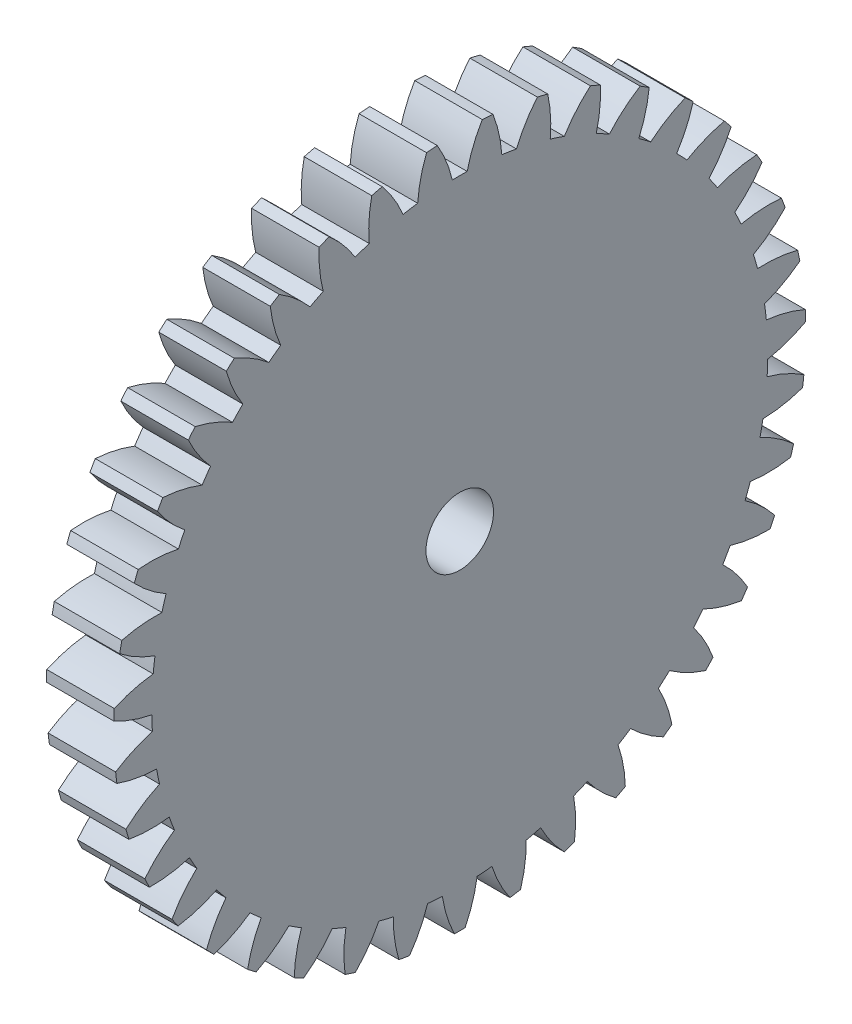
from build123d import *

# Parameters (mm, degrees)
BASPROSKE_W     = 1
BASPROSKE_H     = 5.125
TOOTHCUT_DEPTH  = 8.316505313
TEETHCUTS_COUNT = 39
TEETHCUTS_ANGLE = 350.769230769
BORSKE_R        = 0.5
BORE_DEPTH      = 50.0000508


with BuildPart() as part:
    # BasProSke → Base-Revolve (revolve)
    with BuildSketch(Plane(origin=(0, 0, 0), x_dir=(1, 0, 0), z_dir=(0, 1, 0)), mode=Mode.PRIVATE) as base_revolve_sk:
        with Locations((0.5, 2.5625)):
            Rectangle(BASPROSKE_W, BASPROSKE_H)
    revolve(base_revolve_sk.sketch.rotate(Axis((-10, 0, 0), (1, 0, 0)), 180), axis=Axis((-10, 0, 0), (1, 0, 0)))

    # TooCutSke → ToothCut (cut, through all)
    with BuildSketch(Plane(origin=(0, 0, 0), x_dir=(0, 0, -1), z_dir=(1, 0, 0))):
        with BuildLine():
            ThreePointArc((0.1098841, 4.560176283), (0, 4.5615), (-0.1098841, 4.560176283))
            ThreePointArc((-0.1098841, 4.560176283), (-0.205541216, 4.85901222), (-0.347889478, 5.138637278))
            ThreePointArc((-0.347889478, 5.138637278), (0, 5.1504), (0.347889478, 5.138637278))
            ThreePointArc((0.347889478, 5.138637278), (0.205541216, 4.85901222), (0.1098841, 4.560176283))
        make_face()
    toothcut = extrude(amount=TOOTHCUT_DEPTH, mode=Mode.SUBTRACT)

    # TeethCuts: ToothCut ×39 about axis
    teethcuts_axis = Axis((-10, 0, 0), (1, 0, 0))
    for i in range(1, TEETHCUTS_COUNT):
        add(toothcut.rotate(teethcuts_axis, i * TEETHCUTS_ANGLE / (TEETHCUTS_COUNT - 1)), mode=Mode.SUBTRACT)

    # BorSke → Bore (cut, symmetric)
    with BuildSketch(Plane(origin=(0, 0, 0), x_dir=(0, 0, -1), z_dir=(1, 0, 0))):
        with Locations(Location((0, 0, 0), (0, 0, 180))):
            Circle(BORSKE_R)
    extrude(amount=BORE_DEPTH, both=True, mode=Mode.SUBTRACT)


solid = part.part
